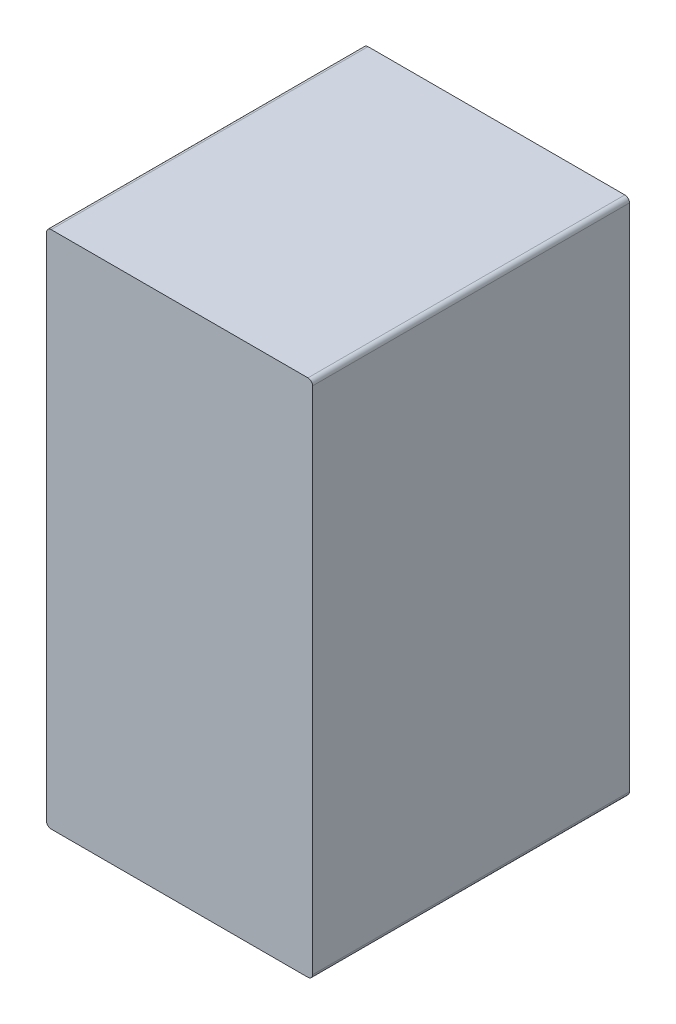
from build123d import *

# Parameters (mm, degrees)
BOSS_EXTRUDE1_DEPTH = 170
BOSS_EXTRUDE2_DEPTH = 1.5


with BuildPart() as part:
    # Sketch1 → Boss-Extrude1 (new body)
    with BuildSketch(Plane.XY):
        with BuildLine():
            Line((69.5, 140.5), (-69.5, 140.5))
            ThreePointArc((-69.5, 140.5), (-71.267766953, 139.767766953), (-72, 138))
            Line((-72, 138), (-72, -138))
            ThreePointArc((-72, -138), (-71.267766953, -139.767766953), (-69.5, -140.5))
            Line((-69.5, -140.5), (69.5, -140.5))
            ThreePointArc((69.5, -140.5), (71.267766953, -139.767766953), (72, -138))
            Line((72, -138), (72, 138))
            ThreePointArc((72, 138), (71.267766953, 139.767766953), (69.5, 140.5))
        make_face()
        with BuildLine():
            Line((-69.5, -139), (69.5, -139))
            ThreePointArc((69.5, -139), (70.207106781, -138.707106781), (70.5, -138))
            Line((70.5, -138), (70.5, 138))
            ThreePointArc((70.5, 138), (70.207106781, 138.707106781), (69.5, 139))
            Line((69.5, 139), (-69.5, 139))
            ThreePointArc((-69.5, 139), (-70.207106781, 138.707106781), (-70.5, 138))
            Line((-70.5, 138), (-70.5, -138))
            ThreePointArc((-70.5, -138), (-70.207106781, -138.707106781), (-69.5, -139))
        make_face(mode=Mode.SUBTRACT)
    extrude(amount=BOSS_EXTRUDE1_DEPTH)

    # Sketch2 → Boss-Extrude2 (add)
    with BuildSketch(Plane.XY.offset(170)):
        with BuildLine():
            Line((-69.5, -140.5), (69.5, -140.5))
            ThreePointArc((69.5, -140.5), (71.267766953, -139.767766953), (72, -138))
            Line((72, -138), (72, 138))
            ThreePointArc((72, 138), (71.267766953, 139.767766953), (69.5, 140.5))
            Line((69.5, 140.5), (-69.5, 140.5))
            ThreePointArc((-69.5, 140.5), (-71.267766953, 139.767766953), (-72, 138))
            Line((-72, 138), (-72, -138))
            ThreePointArc((-72, -138), (-71.267766953, -139.767766953), (-69.5, -140.5))
        make_face()
    extrude(amount=BOSS_EXTRUDE2_DEPTH)


solid = part.part
